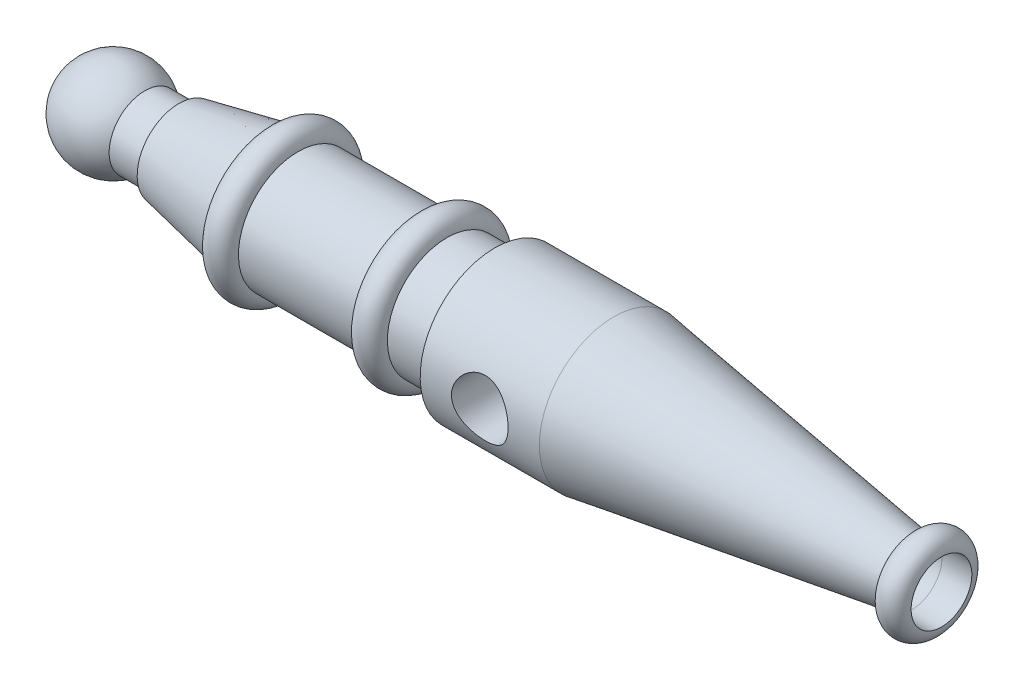
from build123d import *

# Parameters (mm, degrees)
CORTE_EXTRUS_O1_DEPTH      = 141.119591895
CORTE_EXTRUS_O1_DEPTH_BACK = 141.119591895
ESBO_O2_R                  = 4.75
ESBO_O3_R                  = 5.096271857
CORTE_EXTRUS_O2_DEPTH      = 50


with BuildPart() as part:
    # Esboço1 → Revolução2 (revolve)
    with BuildSketch(Plane.XY):
        with BuildLine():
            Line((11, 6), (5.291502622, 6))
            ThreePointArc((5.291502622, 6), (-3.291502622, 7.291502622), (-8, 0))
            Line((-8, 0), (5.291502622, 0))
            Line((5.291502622, 0), (11, 0))
            Line((11, 0), (26, 0))
            Line((26, 0), (31, 0))
            Line((31, 0), (51, 0))
            Line((51, 0), (56, 0))
            Line((56, 0), (64, 0))
            Line((64, 0), (84, 0))
            Line((84, 0), (139, 0))
            Line((139, 0), (139, 5.096271857))
            ThreePointArc((139, 5.096271857), (136.5, 7.596271857), (134, 5.096271857))
            Line((134, 5.096271857), (84, 12.5))
            Line((84, 12.5), (64.003354996, 12.5))
            Line((64.003354996, 12.5), (64, 12.5))
            Line((64, 12.5), (64, 10))
            Line((64, 10), (56, 10))
            ThreePointArc((56, 10), (53.5, 12.5), (51, 10))
            Line((51, 10), (31, 10))
            ThreePointArc((31, 10), (28.5, 12.5), (26, 10))
            Line((26, 10), (11, 7))
            Line((11, 7), (11, 6))
        make_face()
    revolve(axis=Axis((84, 0, 0), (-1, 0, 0)))

    # Esboço2 → Corte-extrusão1 (cut, two sides: drawn at the far end of the back side and taken through both)
    with BuildSketch(Plane.XY.offset(-CORTE_EXTRUS_O1_DEPTH_BACK)):
        with Locations((74, 0)):
            Circle(ESBO_O2_R)
    extrude(amount=CORTE_EXTRUS_O1_DEPTH + CORTE_EXTRUS_O1_DEPTH_BACK, mode=Mode.SUBTRACT)

    # Esboço3 → Corte-extrusão2 (cut)
    with BuildSketch(Plane(origin=(139, 0, 0), x_dir=(0, 0, -1), z_dir=(1, 0, 0))):
        with Locations(Location((0, 0, 0), (0, 0, 90))):
            Circle(ESBO_O3_R)
    extrude(amount=-CORTE_EXTRUS_O2_DEPTH, mode=Mode.SUBTRACT)


with BuildPart() as corte_extrus_o2_piece_1:
    # of the separate pieces the step leaves, piece 1, a body of its own (corte_extrus_o2_pieces)
    add(part.part.solids().sort_by_distance((26, 10, 0))[0])


with BuildPart() as corte_extrus_o2_piece_2:
    # of the separate pieces the step leaves, piece 2, a body of its own (corte_extrus_o2_pieces)
    add(part.part.solids().sort_by_distance((139, 5.096271857, 0))[0])


solid = Compound([corte_extrus_o2_piece_1.part, corte_extrus_o2_piece_2.part])
